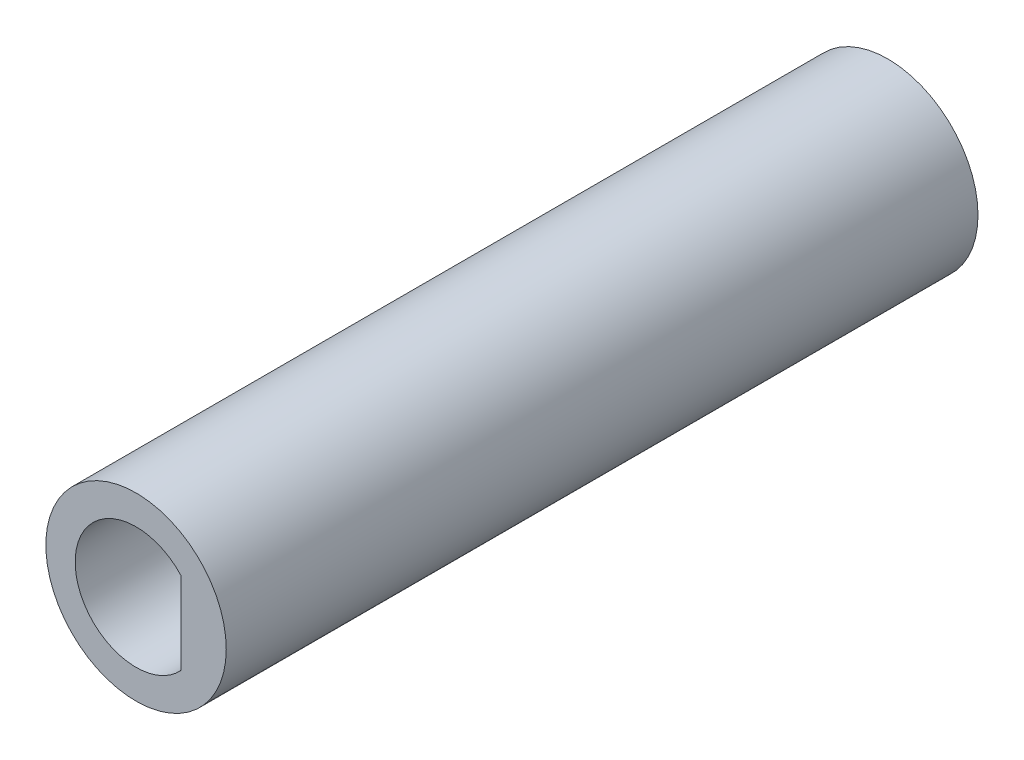
from build123d import *

# Parameters (mm, degrees)
SKETCH1_R           = 6
BOSS_EXTRUDE1_DEPTH = 15
BOSS_EXTRUDE2_START = -35
SKETCH2_R           = 6
BOSS_EXTRUDE2_DEPTH = 35


with BuildPart() as part:
    # Sketch1 → Boss-Extrude1 (new body)
    with BuildSketch(Plane.XY):
        Circle(SKETCH1_R)
        with BuildLine():
            Line((3, 2.720753572), (3, -2.720753572))
            ThreePointArc((3, -2.720753572), (-4.05, 0), (3, 2.720753572))
        make_face(mode=Mode.SUBTRACT)
    extrude(amount=BOSS_EXTRUDE1_DEPTH)

    # Sketch2 → Boss-Extrude2 (add)
    with BuildSketch(Plane.XY.offset(BOSS_EXTRUDE2_START)):
        Circle(SKETCH2_R)
    extrude(amount=BOSS_EXTRUDE2_DEPTH)


solid = part.part
